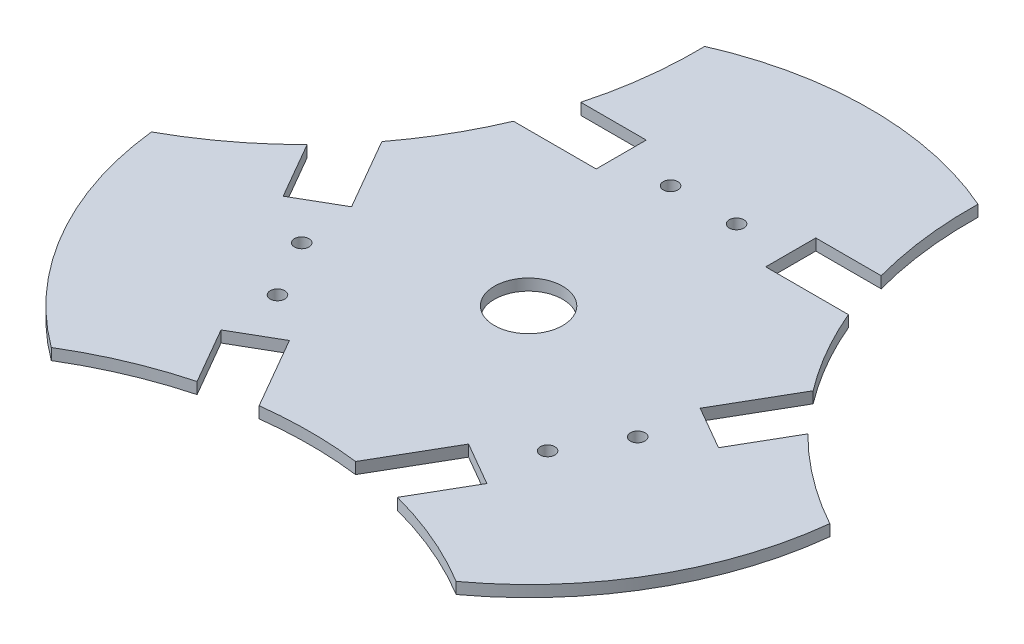
from build123d import *

# Parameters (mm, degrees)
ESQUISSE1_R        = 3.2
ESQUISSE1_R_2      = 15
BOSS_EXTRU_1_DEPTH = 5


with BuildPart() as part:
    # Esquisse1 → Boss.-Extru.1 (new body)
    with BuildSketch(Plane(origin=(0, 0, 0), x_dir=(1, 0, 0), z_dir=(0, 1, 0))):
        with BuildLine():
            Line((95.704424879, -12.251847565), (76.653223752, -1.249496196))
            Line((76.653223752, -1.249496196), (87.655575121, 17.80170493))
            Line((87.655575121, 17.80170493), (94.826792906, 30.219078976))
            ThreePointArc((94.826792906, 30.219078976), (83.075750919, 47.929028471), (73.600020266, 66.953744698))
            Line((73.600020266, 66.953744698), (59.253871219, 66.953744698))
            Line((59.253871219, 66.953744698), (37.253871219, 66.953744698))
            Line((37.253871219, 66.953744698), (37.253871219, 88.953744698))
            Line((37.253871219, 88.953744698), (59.253871219, 88.953744698))
            Line((59.253871219, 88.953744698), (66.003069732, 88.953744698))
            ThreePointArc((66.003069732, 88.953744698), (61.294306765, 112.991978793), (60.05, 137.455438234))
            ThreePointArc((60.05, 137.455438234), (0, 150), (-60.05, 137.455438234))
            ThreePointArc((-60.05, 137.455438234), (-61.294306765, 112.991978793), (-66.003069732, 88.953744698))
            Line((-66.003069732, 88.953744698), (-59.253871219, 88.953744698))
            Line((-59.253871219, 88.953744698), (-37.253871219, 88.953744698))
            Line((-37.253871219, 88.953744698), (-37.253871219, 66.953744698))
            Line((-37.253871219, 66.953744698), (-59.253871219, 66.953744698))
            Line((-59.253871219, 66.953744698), (-73.600020266, 66.953744698))
            ThreePointArc((-73.600020266, 66.953744698), (-83.054066993, 47.966565203), (-94.774500839, 30.288233406))
            Line((-94.774500839, 30.288233406), (-87.606022607, 17.864984041))
            Line((-87.606022607, 17.864984041), (-76.610725847, -1.190289486))
            Line((-76.610725847, -1.190289486), (-95.665999373, -12.185586245))
            Line((-95.665999373, -12.185586245), (-106.661296133, 6.869687281))
            Line((-106.661296133, 6.869687281), (-110.03272827, 12.712509258))
            ThreePointArc((-110.03272827, 12.712509258), (-128.500854083, -3.381043685), (-149.069024712, -16.686098152))
            ThreePointArc((-149.069024712, -16.686098152), (-129.922319498, -74.967932452), (-89.044700128, -120.710568631))
            ThreePointArc((-89.044700128, -120.710568631), (-67.232592853, -109.561304368), (-44.057183789, -101.625654924))
            Line((-44.057183789, -101.625654924), (-47.428615926, -95.782832947))
            Line((-47.428615926, -95.782832947), (-58.423912686, -76.727559421))
            Line((-58.423912686, -76.727559421), (-39.36863916, -65.732262661))
            Line((-39.36863916, -65.732262661), (-28.3733424, -84.787536188))
            Line((-28.3733424, -84.787536188), (-21.204864167, -97.210785553))
            ThreePointArc((-21.204864167, -97.210785553), (0.007838221, -95.910230344), (21.218905144, -97.237191709))
            Line((21.218905144, -97.237191709), (28.390122928, -84.819817663))
            Line((28.390122928, -84.819817663), (39.392474297, -65.768616537))
            Line((39.392474297, -65.768616537), (58.443675423, -76.770967905))
            Line((58.443675423, -76.770967905), (47.441324055, -95.822169032))
            Line((47.441324055, -95.822169032), (44.059067466, -101.678739902))
            ThreePointArc((44.059067466, -101.678739902), (67.188172186, -109.626679928), (88.955287671, -120.776474511))
            ThreePointArc((88.955287671, -120.776474511), (129.894553134, -75.01603206), (149.069024712, -16.686098152))
            ThreePointArc((149.069024712, -16.686098152), (128.532739261, -3.405050916), (110.089032837, 12.655924432))
            Line((110.089032837, 12.655924432), (106.706776248, 6.799353561))
            Line((106.706776248, 6.799353561), (95.704424879, -12.251847565))
        make_face()
        with Locations(Location((14.5, 76.893024973, 0), (0, 0, 270))):
            Circle(ESQUISSE1_R, mode=Mode.SUBTRACT)
        with Locations(Location((-14.5, 76.893024973, 0), (0, 0, 270))):
            Circle(ESQUISSE1_R, mode=Mode.SUBTRACT)
        with Locations(Location((-73.847701188, -25.870916463, 0), (0, 0, 270))):
            Circle(ESQUISSE1_R, mode=Mode.SUBTRACT)
        with Locations(Location((-59.353900914, -50.989231566, 0), (0, 0, 270))):
            Circle(ESQUISSE1_R, mode=Mode.SUBTRACT)
        with Locations(Location((59.348929552, -51.019238622, 0), (0, 0, 270))):
            Circle(ESQUISSE1_R, mode=Mode.SUBTRACT)
        with Locations(Location((73.852029084, -25.906291683, 0), (0, 0, 270))):
            Circle(ESQUISSE1_R, mode=Mode.SUBTRACT)
        with Locations(Location((0, 0, 0), (0, 0, 270))):
            Circle(ESQUISSE1_R_2, mode=Mode.SUBTRACT)
    extrude(amount=BOSS_EXTRU_1_DEPTH)


solid = part.part
